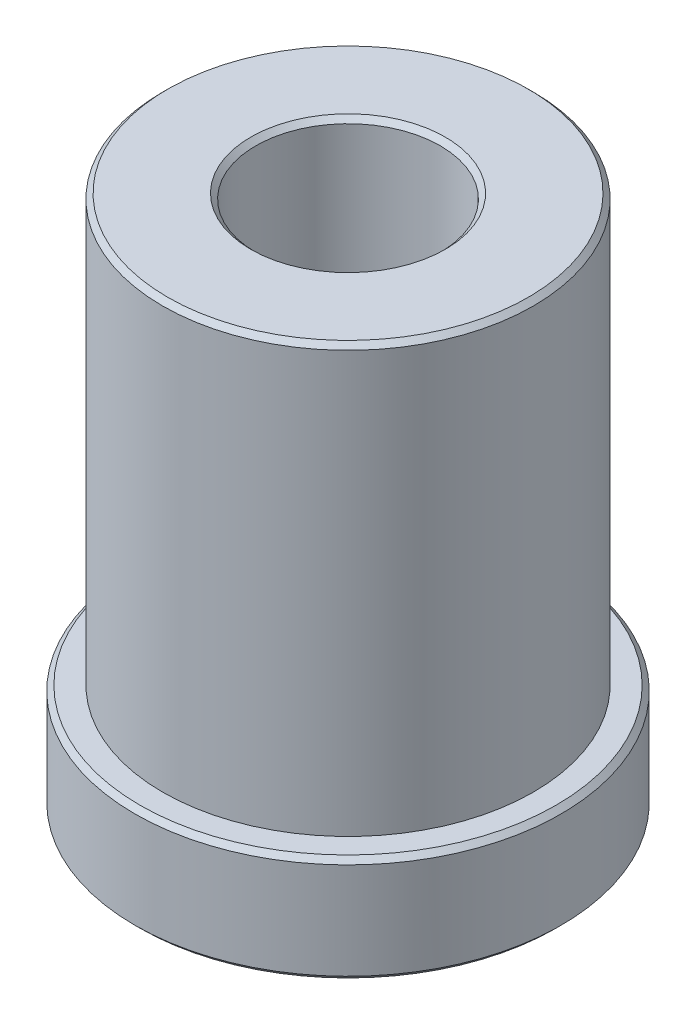
from build123d import *

# Parameters (mm, degrees)
SKETCH1_R           = 11.049
BOSS_EXTRUDE1_DEPTH = 25.4
SKETCH2_R           = 12.7
BOSS_EXTRUDE2_DEPTH = 6.35
SKETCH5_R           = 11.176
CUT_EXTRUDE2_DEPTH  = 5.545328
SKETCH6_R           = 7.27456
CUT_EXTRUDE3_DEPTH  = 0.1999996
SKETCH3_R           = 5.500000049
CUT_EXTRUDE1_DEPTH  = 37.477972806
CHAMFER1_SIZE       = 0.299999908


with BuildPart() as part:
    # Sketch1 → Boss-Extrude1 (new body)
    with BuildSketch(Plane(origin=(0, 0, 0), x_dir=(1, 0, 0), z_dir=(0, 1, 0))):
        with Locations(Location((0, 0, 0), (0, 0, 270))):
            Circle(SKETCH1_R)
    extrude(amount=BOSS_EXTRUDE1_DEPTH)

    # Sketch2 → Boss-Extrude2 (add)
    with BuildSketch(Plane.XZ):
        with Locations(Location((0, 0, 0), (0, 0, 270))):
            Circle(SKETCH2_R)
    extrude(amount=BOSS_EXTRUDE2_DEPTH)

    # Sketch5 → Cut-Extrude2 (cut)
    with BuildSketch(Plane.XZ.offset(6.35)):
        with Locations(Location((0, 0, 0), (0, 0, 270))):
            Circle(SKETCH5_R)
    extrude(amount=-CUT_EXTRUDE2_DEPTH, mode=Mode.SUBTRACT)

    # Sketch6 → Cut-Extrude3 (cut)
    with BuildSketch(Plane.XZ.offset(0.804672)):
        with Locations(Location((0, 0, 0), (0, 0, 270))):
            Circle(SKETCH6_R)
    extrude(amount=-CUT_EXTRUDE3_DEPTH, mode=Mode.SUBTRACT)

    # Sketch3 → Cut-Extrude1 (cut, through all)
    with BuildSketch(Plane.XZ.offset(6.35)):
        with Locations(Location((0, 0, 0), (0, 0, 270))):
            Circle(SKETCH3_R)
    extrude(amount=-CUT_EXTRUDE1_DEPTH, mode=Mode.SUBTRACT)

    # Chamfer1
    chamfer1_edges = [part.edges().sort_by_distance(p)[0] for p in [
        (0, -6.35, 11.176),
        (0, -0.6046724, 5.500000049),
        (0, 25.4, 5.500000049),
        (0, 25.4, -11.049),
        (0, 0, 12.7),
        (0, -6.35, 12.7),
    ]]
    chamfer(chamfer1_edges, length=CHAMFER1_SIZE)


solid = part.part
